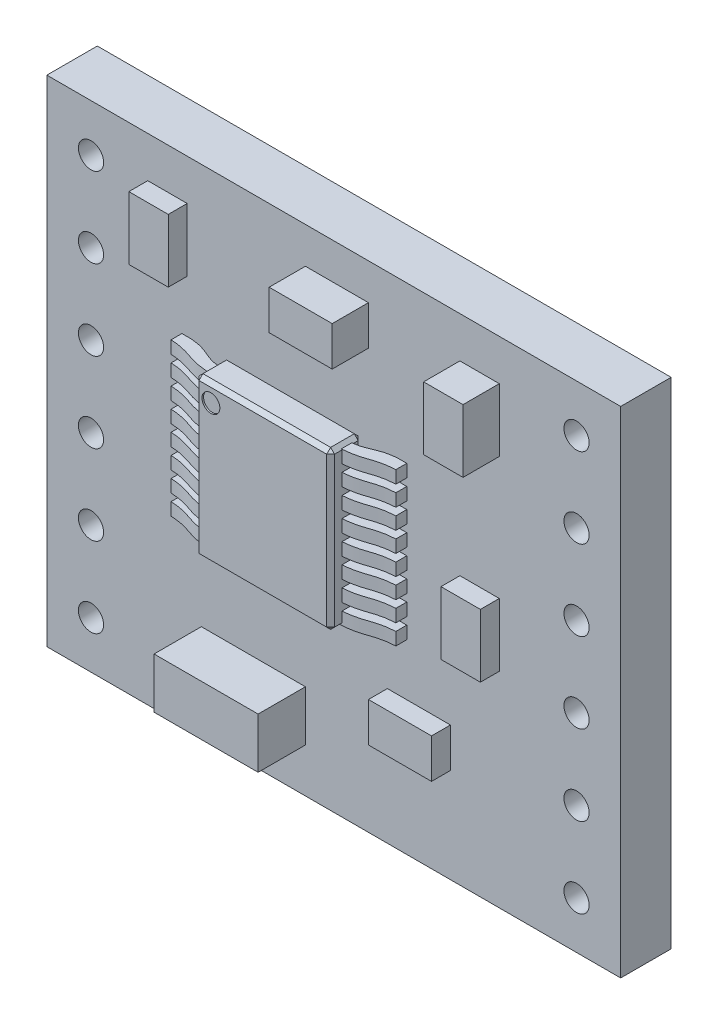
from build123d import *

# Parameters (mm, degrees)
ESQUISSE1_W                = 18.2
ESQUISSE1_H                = 15.7
ESQUISSE1_R                = 0.4
BOSS_EXTRU_1_DEPTH         = 1.6
ESQUISSE2_W                = 2
ESQUISSE2_H                = 1.25
ESQUISSE2_W_2              = 1.25
ESQUISSE2_H_2              = 2
BOSS_EXTRU_2_DEPTH         = 0.6
ESQUISSE2_3_W              = 1.25
ESQUISSE2_3_H              = 2
ESQUISSE2_3_W_2            = 2
ESQUISSE2_3_H_2            = 1.25
BOSS_EXTRU_3_DEPTH         = 1.15
ESQUISSE5_W                = 3.3
ESQUISSE5_H                = 1.6
BOSS_EXTRU_4_DEPTH         = 1.5
ESQUISSE6_W                = 4.3
ESQUISSE6_H                = 5
BOSS_EXTRU_5_DEPTH         = 1
CHANFREIN1_SIZE            = 0.125
ESQUISSE7_R                = 0.283294517
ENL_V_MAT_EXTRU_1_DEPTH    = 0.05
BOSS_EXTRU_6_START         = -0.05
BOSS_EXTRU_6_DEPTH         = 0.4
R_P_TITION_LIN_AIRE1_COUNT = 8
R_P_TITION_LIN_AIRE1_PITCH = 0.635


with BuildPart() as part:
    # Esquisse1 → Boss.-Extru.1 (new body)
    with BuildSketch(Plane.XY):
        Rectangle(ESQUISSE1_W, ESQUISSE1_H)
        with Locations((-7.7, 1.27)):
            Circle(ESQUISSE1_R, mode=Mode.SUBTRACT)
        with Locations((-7.7, 3.81)):
            Circle(ESQUISSE1_R, mode=Mode.SUBTRACT)
        with Locations((-7.7, 6.35)):
            Circle(ESQUISSE1_R, mode=Mode.SUBTRACT)
        with Locations((-7.7, -6.35)):
            Circle(ESQUISSE1_R, mode=Mode.SUBTRACT)
        with Locations((-7.7, -3.81)):
            Circle(ESQUISSE1_R, mode=Mode.SUBTRACT)
        with Locations((-7.7, -1.27)):
            Circle(ESQUISSE1_R, mode=Mode.SUBTRACT)
        with Locations((7.7, -1.27)):
            Circle(ESQUISSE1_R, mode=Mode.SUBTRACT)
        with Locations((7.7, -3.81)):
            Circle(ESQUISSE1_R, mode=Mode.SUBTRACT)
        with Locations((7.7, -6.35)):
            Circle(ESQUISSE1_R, mode=Mode.SUBTRACT)
        with Locations((7.7, 6.35)):
            Circle(ESQUISSE1_R, mode=Mode.SUBTRACT)
        with Locations((7.7, 3.81)):
            Circle(ESQUISSE1_R, mode=Mode.SUBTRACT)
        with Locations((7.7, 1.27)):
            Circle(ESQUISSE1_R, mode=Mode.SUBTRACT)
    extrude(amount=-BOSS_EXTRU_1_DEPTH)

    # Esquisse2 → Boss.-Extru.2 (add)
    with BuildSketch(Plane.XY):
        with Locations((2.7, -4.225)):
            Rectangle(ESQUISSE2_W, ESQUISSE2_H)
        with Locations((-5.275, 5.55)):
            Rectangle(ESQUISSE2_W_2, ESQUISSE2_H_2)
        with Locations((4.625, -0.35)):
            Rectangle(ESQUISSE2_W_2, ESQUISSE2_H_2)
    extrude(amount=BOSS_EXTRU_2_DEPTH)

    # Esquisse2<3> → Boss.-Extru.3 (add)
    with BuildSketch(Plane.XY):
        with Locations((4.625, 5.55)):
            Rectangle(ESQUISSE2_3_W, ESQUISSE2_3_H)
        with Locations((0.1, 6.075)):
            Rectangle(ESQUISSE2_3_W_2, ESQUISSE2_3_H_2)
    extrude(amount=BOSS_EXTRU_3_DEPTH)

    # Esquisse5 → Boss.-Extru.4 (add)
    with BuildSketch(Plane.XY):
        with Locations((-2.55, -5.65)):
            Rectangle(ESQUISSE5_W, ESQUISSE5_H)
    extrude(amount=BOSS_EXTRU_4_DEPTH)


with BuildPart() as body_2:
    # Esquisse6 → Boss.-Extru.5 (new body)
    with BuildSketch(Plane.XY):
        with Locations((-1.25, 0.5)):
            Rectangle(ESQUISSE6_W, ESQUISSE6_H)
    extrude(amount=BOSS_EXTRU_5_DEPTH)

    # Chanfrein1
    chanfrein1_edges = [body_2.edges().sort_by_distance(p)[0] for p in [
        (-1.25, 3, 1),
        (0.9, 3, 0.5),
        (0.9, 0.5, 1),
        (0.9, -2, 0.5),
        (-1.25, -2, 1),
        (-3.4, 3, 0.5),
        (-3.4, 0.5, 1),
        (-3.4, -2, 0.5),
        (-1.25, -2, 0),
        (0.9, 0.5, 0),
        (-1.25, 3, 0),
        (-3.4, 0.5, 0),
    ]]
    chamfer(chanfrein1_edges, length=CHANFREIN1_SIZE)

    # Esquisse7 → Enlèv. mat.-Extru.1 (cut)
    with BuildSketch(Plane.XY.offset(1)):
        with Locations((-2.896783632, 2.443449065)):
            Circle(ESQUISSE7_R)
    extrude(amount=-ENL_V_MAT_EXTRU_1_DEPTH, mode=Mode.SUBTRACT)

    # Esquisse8 → Boss.-Extru.6 (add)
    with BuildSketch(Plane.XZ.offset(2).offset(BOSS_EXTRU_6_START)):
        with BuildLine():
            Line((0.775, 0.646349005), (0.775, 0.309604319))
            add(Edge.make_bspline(
                [(0.775, 0.309604319), (1.37123687, 0.308093208), (1.424478423, -0.037927895), (2.315272534, 0)],
                knots=[0, 0, 0, 0, 1, 1, 1, 1], degree=3))
            Line((2.315272534, 0), (2.315272534, 0.345170386))
            add(Edge.make_bspline(
                [(0.775, 0.646349005), (1.553225818, 0.617616868), (1.609289807, 0.382608864), (2.315272534, 0.345170386)],
                knots=[0, 0, 0, 0, 1, 1, 1, 1], degree=3))
        make_face()
        with BuildLine():
            Line((-3.275, 0.646349005), (-3.275, 0.309604319))
            add(Edge.make_bspline(
                [(-3.275, 0.309604319), (-3.87123687, 0.308093208), (-3.924478423, -0.037927895), (-4.815272534, 0)],
                knots=[0, 0, 0, 0, 1, 1, 1, 1], degree=3))
            Line((-4.815272534, 0), (-4.815272534, 0.345170386))
            add(Edge.make_bspline(
                [(-3.275, 0.646349005), (-4.053225818, 0.617616868), (-4.109289807, 0.382608864), (-4.815272534, 0.345170386)],
                knots=[0, 0, 0, 0, 1, 1, 1, 1], degree=3))
        make_face()
    boss_extru_6 = extrude(amount=-BOSS_EXTRU_6_DEPTH)

    # Répétition linéaire1: Boss.-Extru.6 ×8
    with Locations(*[(0, i * R_P_TITION_LIN_AIRE1_PITCH, 0) for i in range(1, R_P_TITION_LIN_AIRE1_COUNT)]):
        add(boss_extru_6)


solid = Compound([part.part, body_2.part])
